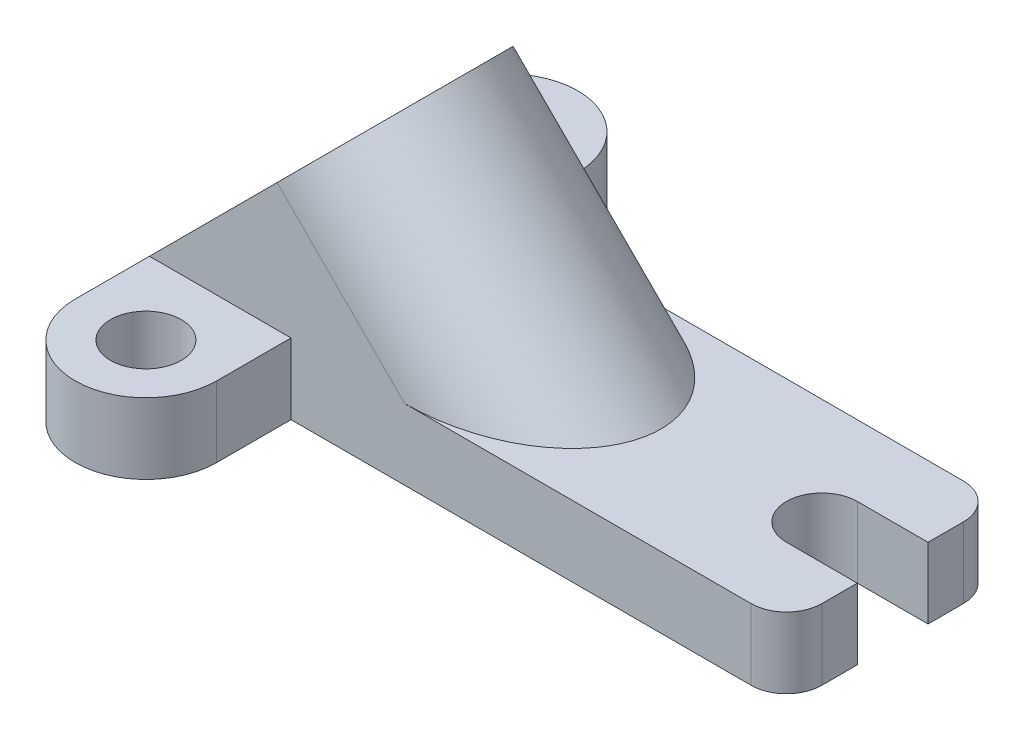
from build123d import *

# Parameters (mm, degrees)
SKETCH1_R           = 10
BOSS_EXTRUDE1_DEPTH = 20
BOSS_EXTRUDE2_REACH = 205.079
CUT_EXTRUDE1_REACH  = 215.698
SKETCH3_R           = 15


with BuildPart() as part:
    # Sketch1 → Boss-Extrude1 (new body)
    with BuildSketch(Plane(origin=(0, 0, 0), x_dir=(1, 0, 0), z_dir=(0, 1, 0))):
        with BuildLine():
            Line((0, 51), (0, -51))
            ThreePointArc((0, -51), (20, -71), (40, -51))
            Line((40, -51), (40, -30))
            Line((40, -30), (170, -30))
            ThreePointArc((170, -30), (177.071067812, -27.071067812), (180, -20))
            Line((180, -20), (180, -10))
            Line((180, -10), (160, -10))
            ThreePointArc((160, -10), (150, 0), (160, 10))
            Line((160, 10), (180, 10))
            Line((180, 10), (180, 20))
            ThreePointArc((180, 20), (177.071067812, 27.071067812), (170, 30))
            Line((170, 30), (40, 30))
            Line((40, 30), (40, 51))
            ThreePointArc((40, 51), (20, 71), (0, 51))
        make_face()
        with Locations(Location((20, -51, 0), (0, 0, 270))):
            Circle(SKETCH1_R, mode=Mode.SUBTRACT)
        with Locations(Location((20, 51, 0), (0, 0, 90))):
            Circle(SKETCH1_R, mode=Mode.SUBTRACT)
    extrude(amount=BOSS_EXTRUDE1_DEPTH)

    # Boss-Extrude2: up to this face of the body (flat: up to its plane)
    boss_extrude2_end = Plane(part.part.faces().sort_by_distance((73.396795742, 20, 0))[0])
    # Sketch2 → Boss-Extrude2 (add, up to the picked face)
    with BuildSketch(Plane(origin=(-10, 10, 0), x_dir=(0, 0, 1), z_dir=(-0.7071067811865512, 0.7071067811865438, 0)), mode=Mode.PRIVATE) as boss_extrude2_sk1:
        with BuildLine():
            Line((30, 14.142135624), (-30, 14.142135624))
            Line((-30, 14.142135624), (-30, 65.142135624))
            ThreePointArc((-30, 65.142135624), (0, 95.142135624), (30, 65.142135624))
            Line((30, 65.142135624), (30, 14.142135624))
        make_face()
    boss_extrude2_tool1 = split(extrude(boss_extrude2_sk1.sketch, amount=-BOSS_EXTRUDE2_REACH, mode=Mode.PRIVATE), bisect_by=boss_extrude2_end, keep=Keep.BOTH, mode=Mode.PRIVATE)
    add(boss_extrude2_tool1.solids().sort_by(Axis((26.574223, 46.574223, 0), (0.7071067811865512, -0.7071067811865438, 0)))[0])

    # Cut-Extrude1: up to this plane
    cut_extrude1_end = Plane(origin=(20, 0, 51), z_dir=(0, 1, 0))
    # Sketch3 → Cut-Extrude1 (cut, up to the surface)
    with BuildSketch(Plane(origin=(-10, 10, 0), x_dir=(0, 0, 1), z_dir=(-0.7071067811865513, 0.7071067811865438, 0)), mode=Mode.PRIVATE) as cut_extrude1_sk1:
        with Locations(Location((0, 65.142135624, 0), (0, 0, 270))):
            Circle(SKETCH3_R)
    cut_extrude1_tool1 = split(extrude(cut_extrude1_sk1.sketch, amount=-CUT_EXTRUDE1_REACH, mode=Mode.PRIVATE), bisect_by=cut_extrude1_end, keep=Keep.BOTH, mode=Mode.PRIVATE)
    add(cut_extrude1_tool1.solids().sort_by_distance((36.062446, 56.062446, 0))[0], mode=Mode.SUBTRACT)


solid = part.part
